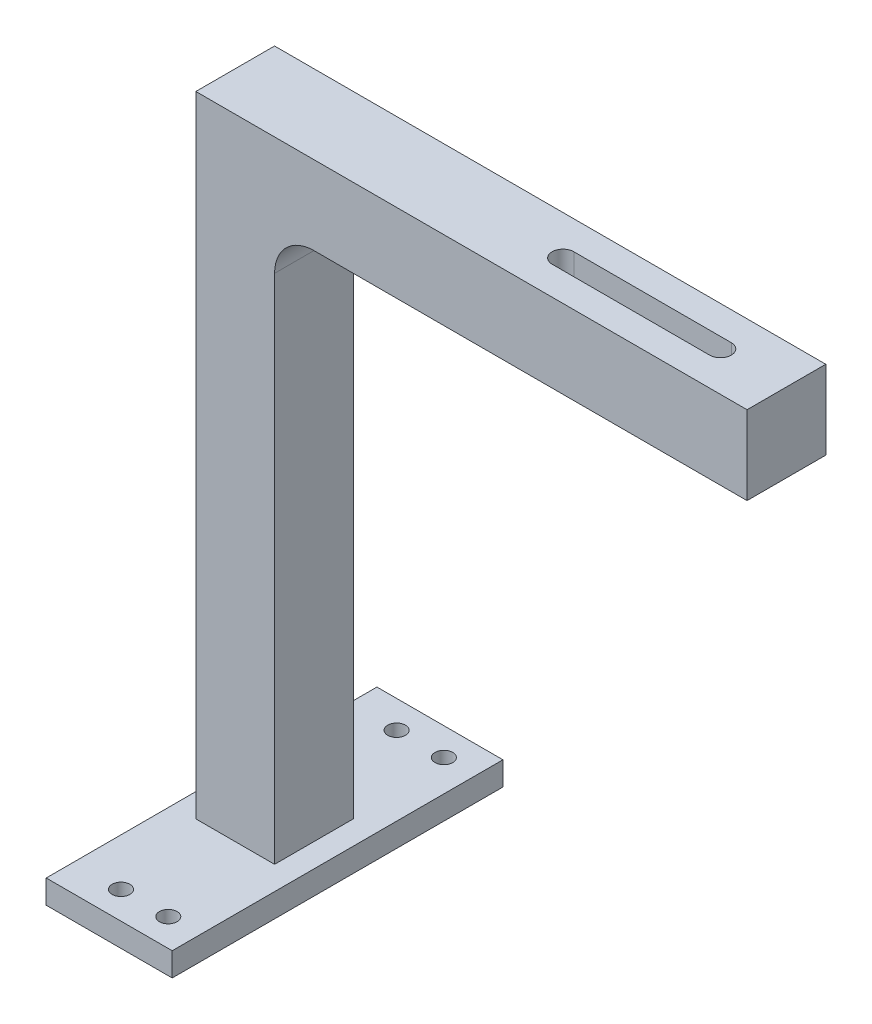
from build123d import *

# Parameters (mm, degrees)
SKETCH2_W                       = 32
SKETCH2_H                       = 84
STALK_FLANGE_32X84X6_DEPTH      = 6
F_4_5_4_5_DIAMETER_HOLE1_D      = 4.5
SKETCH5_W                       = 20
SKETCH5_H                       = 20
VERTICAL_COLUMN_20X20X160_DEPTH = 160
SKETCH6_W                       = 120
SKETCH6_H                       = 20
HORIZONTAL_ARM_20X20X120_DEPTH  = 10
INSIDE_FILLET_R10_R             = 10
TIP_SLOT_40X5_5_THRU_DEPTH      = 259.758574737


with BuildPart() as part:
    # Sketch2 → Stalk_Flange_32x84x6 (new body)
    with BuildSketch(Plane(origin=(0, 0, 0), x_dir=(1, 0, 0), z_dir=(0, 1, 0))):
        with Locations((64, 0)):
            Rectangle(SKETCH2_W, SKETCH2_H)
    extrude(amount=STALK_FLANGE_32X84X6_DEPTH)

    # Ø4.5 (4.5) Diameter Hole1 (through all)
    with Locations(Plane(origin=(0, 6, 0), x_dir=(1, 0, 0), z_dir=(0, 1, 0))):
        with Locations((60, 35), (72, 35), (60, -35), (72, -35)):
            Hole(F_4_5_4_5_DIAMETER_HOLE1_D / 2)

    # Sketch5 → Vertical_Column_20x20x160 (add)
    with BuildSketch(Plane(origin=(0, 6, 0), x_dir=(1, 0, 0), z_dir=(0, 1, 0))):
        with Locations((64, 0)):
            Rectangle(SKETCH5_W, SKETCH5_H)
    extrude(amount=VERTICAL_COLUMN_20X20X160_DEPTH)

    # Sketch6 → Horizontal_Arm_20x20x120 (add, symmetric)
    with BuildSketch(Plane.XY):
        with Locations((134, 156)):
            Rectangle(SKETCH6_W, SKETCH6_H)
    extrude(amount=HORIZONTAL_ARM_20X20X120_DEPTH, both=True)

    # Inside_Fillet_R10
    inside_fillet_r10_edges = [part.edges().sort_by_distance(p)[0] for p in [
        (74, 146, 0),
    ]]
    fillet(inside_fillet_r10_edges, radius=INSIDE_FILLET_R10_R)

    # Sketch7 → Tip_Slot_40x5.5_THRU (cut, through all)
    with BuildSketch(Plane(origin=(0, 166, 0), x_dir=(1, 0, 0), z_dir=(0, 1, 0))):
        with BuildLine():
            Line((177.25, -2.75), (137.25, -2.75))
            ThreePointArc((137.25, -2.75), (134.5, 0), (137.25, 2.75))
            Line((137.25, 2.75), (177.25, 2.75))
            ThreePointArc((177.25, 2.75), (180, 0), (177.25, -2.75))
        make_face()
    extrude(amount=-TIP_SLOT_40X5_5_THRU_DEPTH, mode=Mode.SUBTRACT)


solid = part.part
